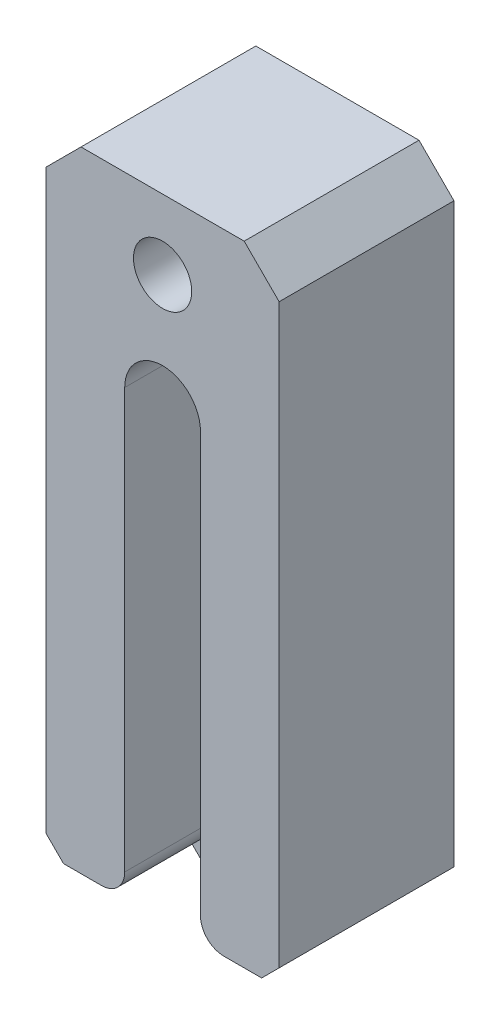
from build123d import *

# Parameters (mm, degrees)
ESQUISSE1_W             = 20
ESQUISSE1_H             = 60
BOSS_EXTRU_1_DEPTH      = 15
ESQUISSE2_R             = 2.5
ENL_V_MAT_EXTRU_1_DEPTH = 15
ESQUISSE3_W             = 20
ESQUISSE3_H             = 6
ENL_V_MAT_EXTRU_2_DEPTH = 9
ENL_V_MAT_EXTRU_3_DEPTH = 15
ESQUISSE7_W             = 6.5
ESQUISSE7_H             = 8
ENL_V_MAT_EXTRU_4_DEPTH = 9
CONG_1_R                = 2
CHANFREIN1_SIZE         = 3


with BuildPart() as part:
    # Esquisse1 → Boss.-Extru.1 (new body)
    with BuildSketch(Plane.XY):
        with Locations((10, 30)):
            Rectangle(ESQUISSE1_W, ESQUISSE1_H)
    extrude(amount=BOSS_EXTRU_1_DEPTH)

    # Esquisse2 → Enlèv. mat.-Extru.1 (cut)
    with BuildSketch(Plane.XY.offset(15)):
        with Locations((10, 54)):
            Circle(ESQUISSE2_R)
        with BuildLine():
            Line((6.75, 12), (6.75, 44))
            ThreePointArc((6.75, 44), (10, 47.25), (13.25, 44))
            Line((13.25, 44), (13.25, 12))
            ThreePointArc((13.25, 12), (10, 8.75), (6.75, 12))
        make_face()
    extrude(amount=-ENL_V_MAT_EXTRU_1_DEPTH, mode=Mode.SUBTRACT)

    # Esquisse3 → Enlèv. mat.-Extru.2 (cut)
    with BuildSketch(Plane.XY.offset(15)):
        with Locations((10, 3)):
            Rectangle(ESQUISSE3_W, ESQUISSE3_H)
    extrude(amount=-ENL_V_MAT_EXTRU_2_DEPTH, mode=Mode.SUBTRACT)

    # Esquisse6 → Enlèv. mat.-Extru.3 (cut)
    with BuildSketch(Plane.XY.offset(15)):
        Polygon((7.5, 0), (0, 7.5), (0, -7.5), (20, -7.5), (20, 7.5), (12.5, 0), align=None)
    extrude(amount=-ENL_V_MAT_EXTRU_3_DEPTH, mode=Mode.SUBTRACT)

    # Esquisse7 → Enlèv. mat.-Extru.4 (cut)
    with BuildSketch(Plane.XY.offset(15)):
        with Locations((10, 10)):
            Rectangle(ESQUISSE7_W, ESQUISSE7_H)
    extrude(amount=-ENL_V_MAT_EXTRU_4_DEPTH, mode=Mode.SUBTRACT)

    # Congé1
    cong_1_edges = [part.edges().sort_by_distance(p)[0] for p in [
        (6.75, 6, 10.5),
        (13.25, 6, 10.5),
    ]]
    fillet(cong_1_edges, radius=CONG_1_R)

    # Chanfrein1
    chanfrein1_edges = [part.edges().sort_by_distance(p)[0] for p in [
        (0, 60, 7.5),
        (20, 60, 7.5),
    ]]
    chamfer(chanfrein1_edges, length=CHANFREIN1_SIZE)


solid = part.part
